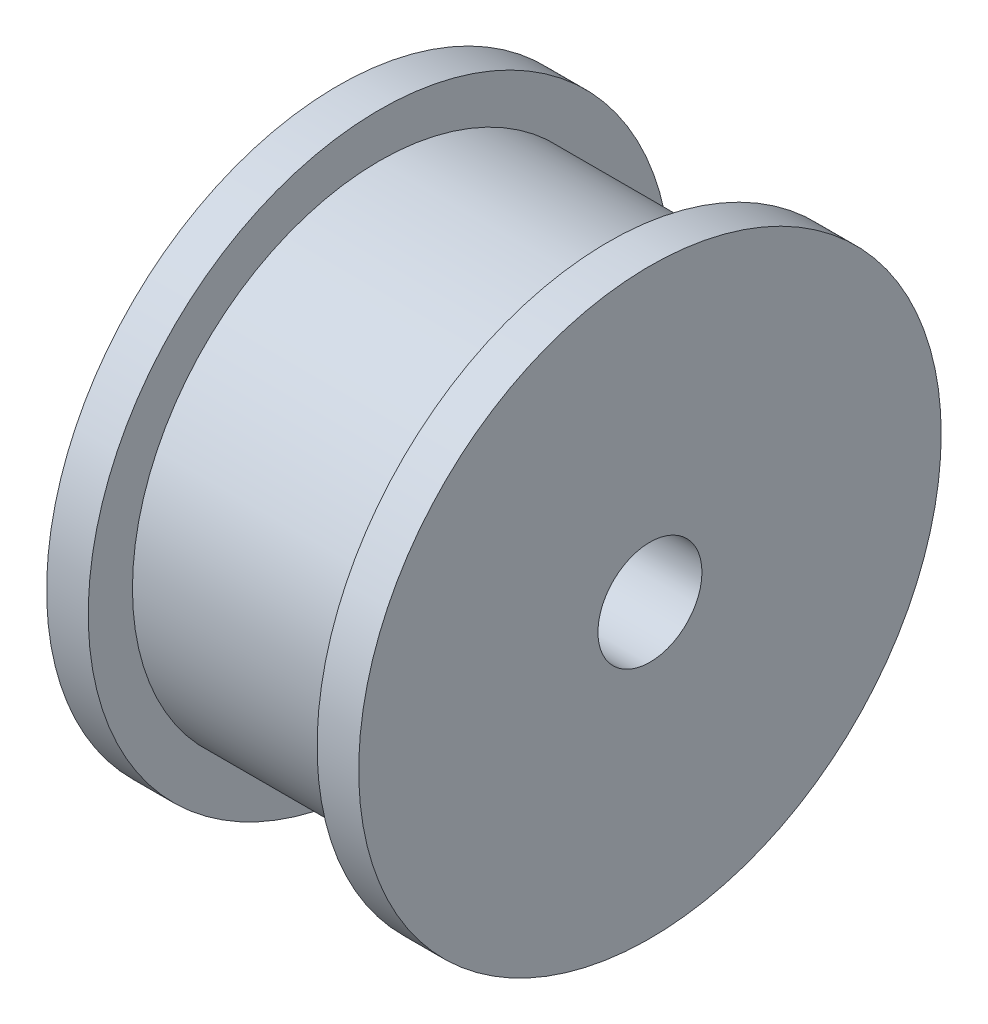
from build123d import *

# Parameters (mm, degrees)
SKETCH1_R           = 14
BOSS_EXTRUDE1_DEPTH = 2
SKETCH2_R           = 11.875
BOSS_EXTRUDE2_DEPTH = 11
SKETCH3_R           = 14
BOSS_EXTRUDE3_DEPTH = 2
SKETCH4_R           = 2.5
CUT_EXTRUDE1_DEPTH  = 25.839484697


with BuildPart() as part:
    # Sketch1 → Boss-Extrude1 (new body)
    with BuildSketch(Plane(origin=(0, 0, 0), x_dir=(0, 0, -1), z_dir=(1, 0, 0))):
        Circle(SKETCH1_R)
    extrude(amount=BOSS_EXTRUDE1_DEPTH)

    # Sketch2 → Boss-Extrude2 (add)
    with BuildSketch(Plane(origin=(2, 0, 0), x_dir=(0, 0, -1), z_dir=(1, 0, 0))):
        Circle(SKETCH2_R)
    extrude(amount=BOSS_EXTRUDE2_DEPTH)

    # Sketch3 → Boss-Extrude3 (add)
    with BuildSketch(Plane(origin=(13, 0, 0), x_dir=(0, 0, -1), z_dir=(1, 0, 0))):
        Circle(SKETCH3_R)
    extrude(amount=BOSS_EXTRUDE3_DEPTH)

    # Sketch4 → Cut-Extrude1 (cut, through all)
    with BuildSketch(Plane(origin=(15, 0, 0), x_dir=(0, 0, -1), z_dir=(1, 0, 0))):
        Circle(SKETCH4_R)
    extrude(amount=-CUT_EXTRUDE1_DEPTH, mode=Mode.SUBTRACT)


solid = part.part
